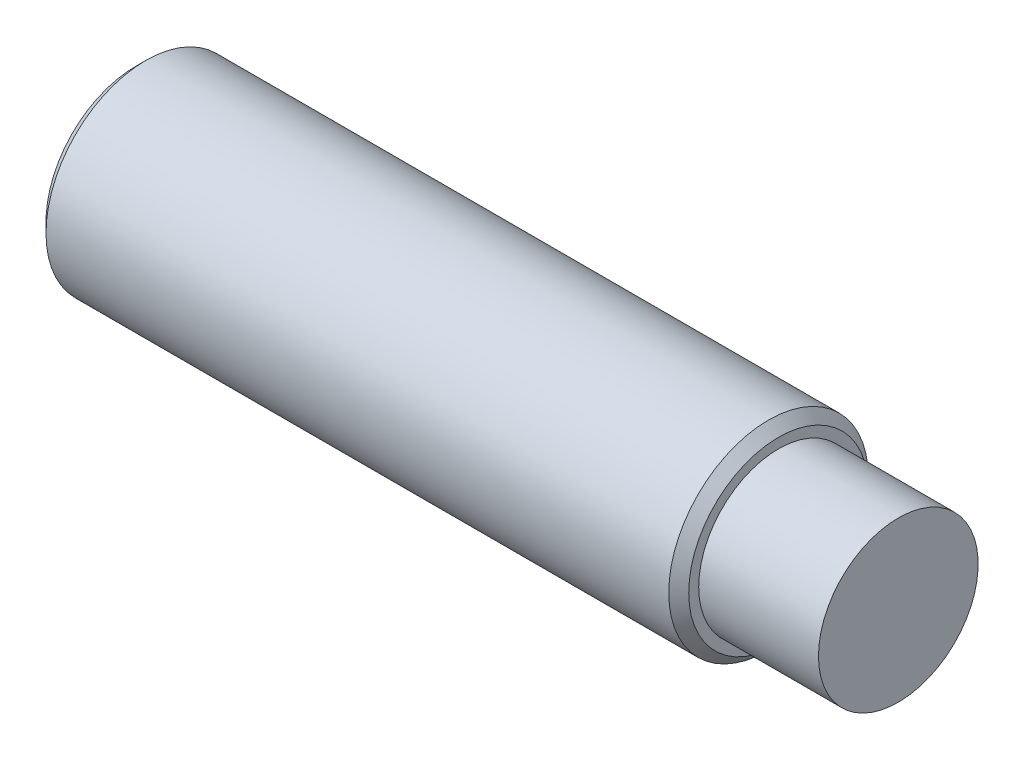
from build123d import *

# Parameters (mm, degrees)
CHAMFER1_SIZE      = 0.5
SKETCH6_R          = 3
CUT_EXTRUDE1_DEPTH = 10


with BuildPart() as part:
    # Sketch1 → Revolve1 (revolve)
    with BuildSketch(Plane.XY, mode=Mode.PRIVATE) as revolve1_sk:
        Polygon((0, 0), (0, 5), (32.2, 5), (32.2, 4), (38.2, 4), (38.2, 0), align=None)
    revolve(revolve1_sk.sketch.rotate(Axis((-21.625122332, 0, 0), (1, 0, 0)), 90), axis=Axis((-21.625122332, 0, 0), (1, 0, 0)))

    # Chamfer1
    chamfer1_edges = [part.edges().sort_by_distance(p)[0] for p in [
        (32.2, 0, -5),
        (0, 0, -5),
    ]]
    chamfer(chamfer1_edges, length=CHAMFER1_SIZE)

    # Sketch6 → Cut-Extrude1 (cut)
    with BuildSketch(Plane.ZY):
        Circle(SKETCH6_R)
    extrude(amount=-CUT_EXTRUDE1_DEPTH, mode=Mode.SUBTRACT)


solid = part.part
